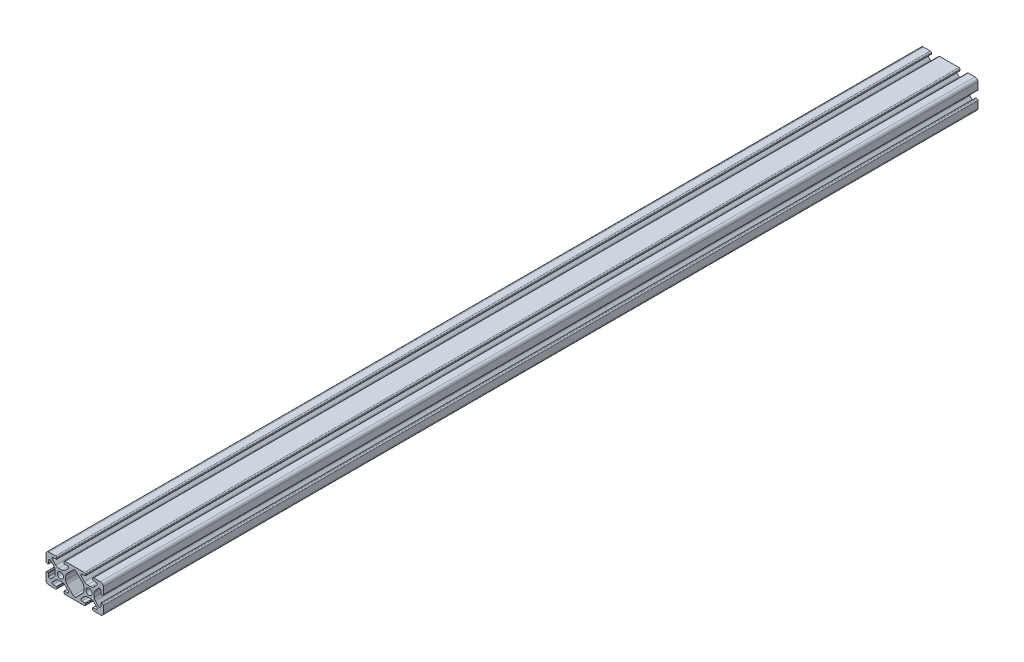
from build123d import *

# Parameters (mm, degrees)
SKETCH1_R           = 2.1463
BOSS_EXTRUDE1_DEPTH = 304.8


with BuildPart() as part:
    # Sketch1 → Boss-Extrude1 (new, symmetric)
    with BuildSketch(Plane.XY):
        with BuildLine():
            Line((-19.9898, 7.9883), (-19.9898, 3.2893))
            ThreePointArc((-19.9898, 3.2893), (-19.75917588, 2.73252412), (-19.2024, 2.5019))
            Line((-19.2024, 2.5019), (-18.4912, 2.5019))
            ThreePointArc((-18.4912, 2.5019), (-18.275673853, 2.591173853), (-18.1864, 2.8067))
            Line((-18.1864, 2.8067), (-18.1864, 4.9149))
            ThreePointArc((-18.1864, 4.9149), (-17.668965253, 5.689295824), (-16.755503096, 5.507596904))
            Line((-16.755503096, 5.507596904), (-14.500665747, 3.252759555))
            ThreePointArc((-14.500665747, 3.252759555), (-13.850954457, 2.280397894), (-13.622806192, 1.133419111))
            Line((-13.622806192, 1.133419111), (-13.622806192, -1.133419111))
            ThreePointArc((-13.622806192, -1.133419111), (-13.850954457, -2.280397894), (-14.500665747, -3.252759555))
            Line((-14.500665747, -3.252759555), (-16.755503096, -5.507596904))
            ThreePointArc((-16.755503096, -5.507596904), (-17.668965253, -5.689295824), (-18.1864, -4.9149))
            Line((-18.1864, -4.9149), (-18.1864, -2.8067))
            ThreePointArc((-18.1864, -2.8067), (-18.275673853, -2.591173853), (-18.4912, -2.5019))
            Line((-18.4912, -2.5019), (-19.2024, -2.5019))
            ThreePointArc((-19.2024, -2.5019), (-19.75917588, -2.73252412), (-19.9898, -3.2893))
            Line((-19.9898, -3.2893), (-19.9898, -7.9883))
            ThreePointArc((-19.9898, -7.9883), (-19.402080467, -9.407180467), (-17.9832, -9.9949))
            Line((-17.9832, -9.9949), (-13.2842, -9.9949))
            ThreePointArc((-13.2842, -9.9949), (-12.72742412, -9.76427588), (-12.4968, -9.2075))
            Line((-12.4968, -9.2075), (-12.4968, -8.4963))
            ThreePointArc((-12.4968, -8.4963), (-12.586073853, -8.280773853), (-12.8016, -8.1915))
            Line((-12.8016, -8.1915), (-14.9098, -8.1915))
            ThreePointArc((-14.9098, -8.1915), (-15.684195824, -7.674065253), (-15.502496904, -6.760603096))
            Line((-15.502496904, -6.760603096), (-13.247659555, -4.505765747))
            ThreePointArc((-13.247659555, -4.505765747), (-12.275297894, -3.856054457), (-11.128319111, -3.627906192))
            Line((-11.128319111, -3.627906192), (-8.861480889, -3.627906192))
            ThreePointArc((-8.861480889, -3.627906192), (-7.714502106, -3.856054457), (-6.742140445, -4.505765747))
            Line((-6.742140445, -4.505765747), (-4.487303096, -6.760603096))
            ThreePointArc((-4.487303096, -6.760603096), (-4.305604176, -7.674065253), (-5.08, -8.1915))
            Line((-5.08, -8.1915), (-7.1882, -8.1915))
            ThreePointArc((-7.1882, -8.1915), (-7.403726147, -8.280773853), (-7.493, -8.4963))
            Line((-7.493, -8.4963), (-7.493, -9.2075))
            ThreePointArc((-7.493, -9.2075), (-7.26237588, -9.76427588), (-6.7056, -9.9949))
            Line((-6.7056, -9.9949), (0, -9.9949))
            Line((0, -9.9949), (6.7056, -9.9949))
            ThreePointArc((6.7056, -9.9949), (7.26237588, -9.76427588), (7.493, -9.2075))
            Line((7.493, -9.2075), (7.493, -8.4963))
            ThreePointArc((7.493, -8.4963), (7.403726147, -8.280773853), (7.1882, -8.1915))
            Line((7.1882, -8.1915), (5.08, -8.1915))
            ThreePointArc((5.08, -8.1915), (4.305604176, -7.674065253), (4.487303096, -6.760603096))
            Line((4.487303096, -6.760603096), (6.742140445, -4.505765747))
            ThreePointArc((6.742140445, -4.505765747), (7.714502106, -3.856054457), (8.861480889, -3.627906192))
            Line((8.861480889, -3.627906192), (11.128319111, -3.627906192))
            ThreePointArc((11.128319111, -3.627906192), (12.275297894, -3.856054457), (13.247659555, -4.505765747))
            Line((13.247659555, -4.505765747), (15.502496904, -6.760603096))
            ThreePointArc((15.502496904, -6.760603096), (15.684195824, -7.674065253), (14.9098, -8.1915))
            Line((14.9098, -8.1915), (12.8016, -8.1915))
            ThreePointArc((12.8016, -8.1915), (12.586073853, -8.280773853), (12.4968, -8.4963))
            Line((12.4968, -8.4963), (12.4968, -9.2075))
            ThreePointArc((12.4968, -9.2075), (12.72742412, -9.76427588), (13.2842, -9.9949))
            Line((13.2842, -9.9949), (17.9832, -9.9949))
            ThreePointArc((17.9832, -9.9949), (19.402080467, -9.407180467), (19.9898, -7.9883))
            Line((19.9898, -7.9883), (19.9898, -3.2893))
            ThreePointArc((19.9898, -3.2893), (19.75917588, -2.73252412), (19.2024, -2.5019))
            Line((19.2024, -2.5019), (18.4912, -2.5019))
            ThreePointArc((18.4912, -2.5019), (18.275673853, -2.591173853), (18.1864, -2.8067))
            Line((18.1864, -2.8067), (18.1864, -4.9149))
            ThreePointArc((18.1864, -4.9149), (17.668965253, -5.689295824), (16.755503096, -5.507596904))
            Line((16.755503096, -5.507596904), (14.500665747, -3.252759555))
            ThreePointArc((14.500665747, -3.252759555), (13.850954457, -2.280397894), (13.622806192, -1.133419111))
            Line((13.622806192, -1.133419111), (13.622806192, 1.133419111))
            ThreePointArc((13.622806192, 1.133419111), (13.850954457, 2.280397894), (14.500665747, 3.252759555))
            Line((14.500665747, 3.252759555), (16.755503096, 5.507596904))
            ThreePointArc((16.755503096, 5.507596904), (17.668965253, 5.689295824), (18.1864, 4.9149))
            Line((18.1864, 4.9149), (18.1864, 2.8067))
            ThreePointArc((18.1864, 2.8067), (18.275673853, 2.591173853), (18.4912, 2.5019))
            Line((18.4912, 2.5019), (19.2024, 2.5019))
            ThreePointArc((19.2024, 2.5019), (19.75917588, 2.73252412), (19.9898, 3.2893))
            Line((19.9898, 3.2893), (19.9898, 7.9883))
            ThreePointArc((19.9898, 7.9883), (19.402080467, 9.407180467), (17.9832, 9.9949))
            Line((17.9832, 9.9949), (13.2842, 9.9949))
            ThreePointArc((13.2842, 9.9949), (12.72742412, 9.76427588), (12.4968, 9.2075))
            Line((12.4968, 9.2075), (12.4968, 8.4963))
            ThreePointArc((12.4968, 8.4963), (12.586073853, 8.280773853), (12.8016, 8.1915))
            Line((12.8016, 8.1915), (14.9098, 8.1915))
            ThreePointArc((14.9098, 8.1915), (15.684195824, 7.674065253), (15.502496904, 6.760603096))
            Line((15.502496904, 6.760603096), (13.247659555, 4.505765747))
            ThreePointArc((13.247659555, 4.505765747), (12.275297894, 3.856054457), (11.128319111, 3.627906192))
            Line((11.128319111, 3.627906192), (8.861480889, 3.627906192))
            ThreePointArc((8.861480889, 3.627906192), (7.714502106, 3.856054457), (6.742140445, 4.505765747))
            Line((6.742140445, 4.505765747), (4.487303096, 6.760603096))
            ThreePointArc((4.487303096, 6.760603096), (4.305604176, 7.674065253), (5.08, 8.1915))
            Line((5.08, 8.1915), (7.1882, 8.1915))
            ThreePointArc((7.1882, 8.1915), (7.403726147, 8.280773853), (7.493, 8.4963))
            Line((7.493, 8.4963), (7.493, 9.2075))
            ThreePointArc((7.493, 9.2075), (7.26237588, 9.76427588), (6.7056, 9.9949))
            Line((6.7056, 9.9949), (0, 9.9949))
            Line((0, 9.9949), (-6.7056, 9.9949))
            ThreePointArc((-6.7056, 9.9949), (-7.26237588, 9.76427588), (-7.493, 9.2075))
            Line((-7.493, 9.2075), (-7.493, 8.4963))
            ThreePointArc((-7.493, 8.4963), (-7.403726147, 8.280773853), (-7.1882, 8.1915))
            Line((-7.1882, 8.1915), (-5.08, 8.1915))
            ThreePointArc((-5.08, 8.1915), (-4.305604176, 7.674065253), (-4.487303096, 6.760603096))
            Line((-4.487303096, 6.760603096), (-6.742140445, 4.505765747))
            ThreePointArc((-6.742140445, 4.505765747), (-7.714502106, 3.856054457), (-8.861480889, 3.627906192))
            Line((-8.861480889, 3.627906192), (-11.128319111, 3.627906192))
            ThreePointArc((-11.128319111, 3.627906192), (-12.275297894, 3.856054457), (-13.247659555, 4.505765747))
            Line((-13.247659555, 4.505765747), (-15.502496904, 6.760603096))
            ThreePointArc((-15.502496904, 6.760603096), (-15.684195824, 7.674065253), (-14.9098, 8.1915))
            Line((-14.9098, 8.1915), (-12.8016, 8.1915))
            ThreePointArc((-12.8016, 8.1915), (-12.586073853, 8.280773853), (-12.4968, 8.4963))
            Line((-12.4968, 8.4963), (-12.4968, 9.2075))
            ThreePointArc((-12.4968, 9.2075), (-12.72742412, 9.76427588), (-13.2842, 9.9949))
            Line((-13.2842, 9.9949), (-17.9832, 9.9949))
            ThreePointArc((-17.9832, 9.9949), (-19.402080467, 9.407180467), (-19.9898, 7.9883))
        make_face()
        with Locations((-9.9949, 0)):
            Circle(SKETCH1_R, mode=Mode.SUBTRACT)
        with Locations(Location((9.9949, 0, 0), (0, 0, 180))):
            Circle(SKETCH1_R, mode=Mode.SUBTRACT)
        with BuildLine():
            Line((-6.366993808, 1.133419111), (-6.366993808, -1.133419111))
            ThreePointArc((-6.366993808, -1.133419111), (-6.138845543, -2.280397894), (-5.489134253, -3.252759555))
            Line((-5.489134253, -3.252759555), (-0.939581002, -7.802312806))
            ThreePointArc((-0.939581002, -7.802312806), (0, -8.1915), (0.939581002, -7.802312806))
            Line((0.939581002, -7.802312806), (5.489134253, -3.252759555))
            ThreePointArc((5.489134253, -3.252759555), (6.138845543, -2.280397894), (6.366993808, -1.133419111))
            Line((6.366993808, -1.133419111), (6.366993808, 1.133419111))
            ThreePointArc((6.366993808, 1.133419111), (6.138845543, 2.280397894), (5.489134253, 3.252759555))
            Line((5.489134253, 3.252759555), (0.939581002, 7.802312806))
            ThreePointArc((0.939581002, 7.802312806), (0, 8.1915), (-0.939581002, 7.802312806))
            Line((-0.939581002, 7.802312806), (-5.489134253, 3.252759555))
            ThreePointArc((-5.489134253, 3.252759555), (-6.138845543, 2.280397894), (-6.366993808, 1.133419111))
        make_face(mode=Mode.SUBTRACT)
    extrude(amount=BOSS_EXTRUDE1_DEPTH, both=True)


solid = part.part
